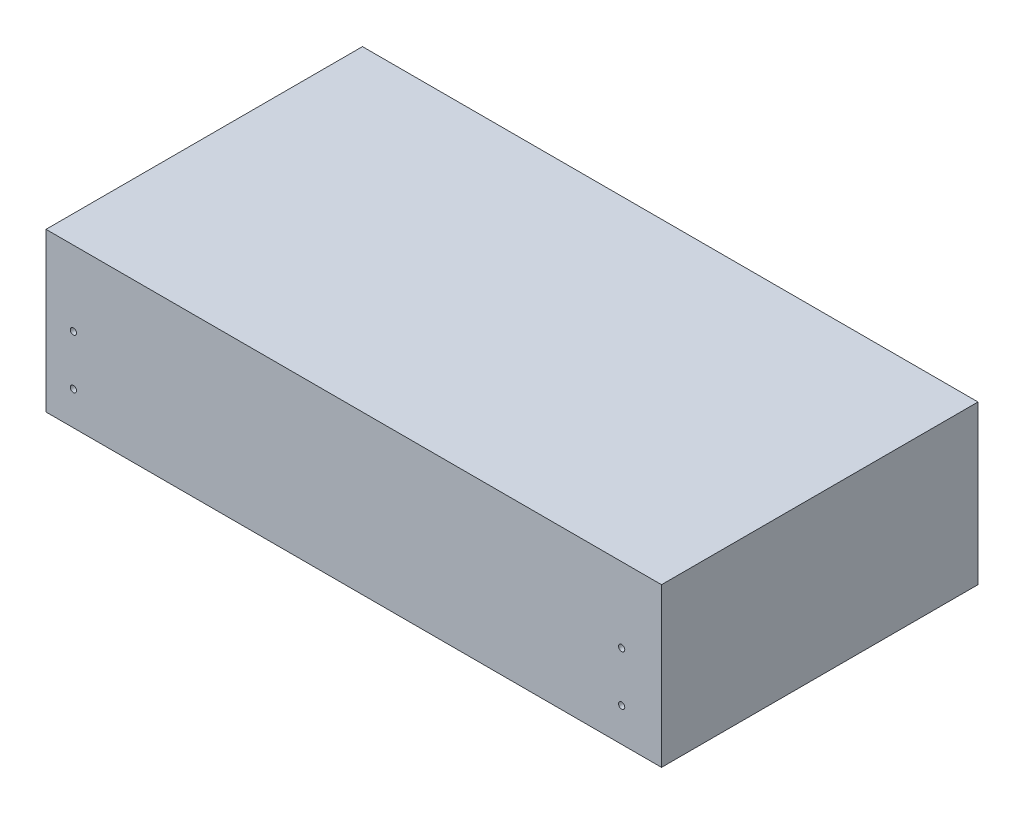
from build123d import *

# Parameters (mm, degrees)
SKETCH1_W                      = 247
SKETCH1_H                      = 127
BOSS_EXTRUDE1_DEPTH            = 63.5
M3X0_5_TAPPED_HOLE1_AT_2_COUNT = 2
M3X0_5_TAPPED_HOLE1_AT_2_PITCH = 20
M3X0_5_TAPPED_HOLE1_AT_3_COUNT = 2
M3X0_5_TAPPED_HOLE1_AT_3_PITCH = 220.907220344
M3X0_5_TAPPED_HOLE1_AT_4_COUNT = 2
M3X0_5_TAPPED_HOLE1_AT_4_PITCH = 220
SKETCH4_W                      = 19.05
SKETCH4_H                      = 6.35
BOSS_EXTRUDE2_DEPTH            = 5
SKETCH5_W                      = 1.5875
SKETCH5_H                      = 6.35
BOSS_EXTRUDE3_DEPTH            = 5


with BuildPart() as part:
    # Sketch1 → Boss-Extrude1 (new body)
    with BuildSketch(Plane(origin=(0, 0, 0), x_dir=(1, 0, 0), z_dir=(0, 1, 0))):
        Rectangle(SKETCH1_W, SKETCH1_H)
    extrude(amount=BOSS_EXTRUDE1_DEPTH)

    # Sketch3 → M3x0.5 Tapped Hole1 (revolve, cut)
    with BuildSketch(Plane(origin=(-112.5, 33.5, 63.5), x_dir=(0, -1, 0), z_dir=(1, 0, 0))):
        Polygon((0, 0), (0, 4.751075774), (1.25, 4), (1.25, 0), align=None)
    m3x0_5_tapped_hole1 = revolve(axis=Axis((-112.5, 33.5, 69.85), (0, 0, -1)), mode=Mode.SUBTRACT)

    # M3x0.5 Tapped Hole1 at 2: M3x0.5 Tapped Hole1 ×2
    with Locations(*[(0, -i * M3X0_5_TAPPED_HOLE1_AT_2_PITCH, 0) for i in range(1, M3X0_5_TAPPED_HOLE1_AT_2_COUNT)]):
        add(m3x0_5_tapped_hole1, mode=Mode.SUBTRACT)

    # M3x0.5 Tapped Hole1 at 3: M3x0.5 Tapped Hole1 ×2
    with Locations(*[Vector(0.9958932064677039, -0.09053574604251853, 0) * (i * M3X0_5_TAPPED_HOLE1_AT_3_PITCH) for i in range(1, M3X0_5_TAPPED_HOLE1_AT_3_COUNT)]):
        add(m3x0_5_tapped_hole1, mode=Mode.SUBTRACT)

    # M3x0.5 Tapped Hole1 at 4: M3x0.5 Tapped Hole1 ×2
    with Locations(*[(i * M3X0_5_TAPPED_HOLE1_AT_4_PITCH, 0, 0) for i in range(1, M3X0_5_TAPPED_HOLE1_AT_4_COUNT)]):
        add(m3x0_5_tapped_hole1, mode=Mode.SUBTRACT)

    # Mirror1: M3x0.5 Tapped Hole1 across plane
    add(m3x0_5_tapped_hole1.mirror(Plane.XY), mode=Mode.SUBTRACT)

    # Mirror1 copy 1 sketch → Mirror1 copy 1 (revolve, cut)
    with BuildSketch(Plane(origin=(-112.5, 13.5, -63.5), x_dir=(0, -1, 0), z_dir=(1, 0, 0))):
        Polygon((0, 0), (0, -4.751075774), (1.25, -4), (1.25, 0), align=None)
    revolve(axis=Axis((-112.5, 13.5, -69.85), (0, 0, -1)), mode=Mode.SUBTRACT)

    # Mirror1 copy 2 sketch → Mirror1 copy 2 (revolve, cut)
    with BuildSketch(Plane(origin=(107.5, 13.5, -63.5), x_dir=(0, -1, 0), z_dir=(1, 0, 0))):
        Polygon((0, 0), (0, -4.751075774), (1.25, -4), (1.25, 0), align=None)
    revolve(axis=Axis((107.5, 13.5, -69.85), (0, 0, -1)), mode=Mode.SUBTRACT)

    # Mirror1 copy 3 sketch → Mirror1 copy 3 (revolve, cut)
    with BuildSketch(Plane(origin=(107.5, 33.5, -63.5), x_dir=(0, -1, 0), z_dir=(1, 0, 0))):
        Polygon((0, 0), (0, -4.751075774), (1.25, -4), (1.25, 0), align=None)
    revolve(axis=Axis((107.5, 33.5, -69.85), (0, 0, -1)), mode=Mode.SUBTRACT)

    # Sketch4 → Boss-Extrude2 (add)
    with BuildSketch(Plane.ZY.offset(123.5)):
        with Locations((38.975, 15.175)):
            Rectangle(SKETCH4_W, SKETCH4_H)
    extrude(amount=BOSS_EXTRUDE2_DEPTH)

    # Sketch5 → Boss-Extrude3 (add)
    with BuildSketch(Plane.ZY.offset(128.5)):
        with Locations((30.24375, 15.175)):
            Rectangle(SKETCH5_W, SKETCH5_H)
        with Locations((36.064583333, 15.175)):
            Rectangle(SKETCH5_W, SKETCH5_H)
        with Locations((47.70625, 15.175)):
            Rectangle(SKETCH5_W, SKETCH5_H)
        with Locations((41.885416667, 15.175)):
            Rectangle(SKETCH5_W, SKETCH5_H)
    extrude(amount=BOSS_EXTRUDE3_DEPTH)


solid = part.part
